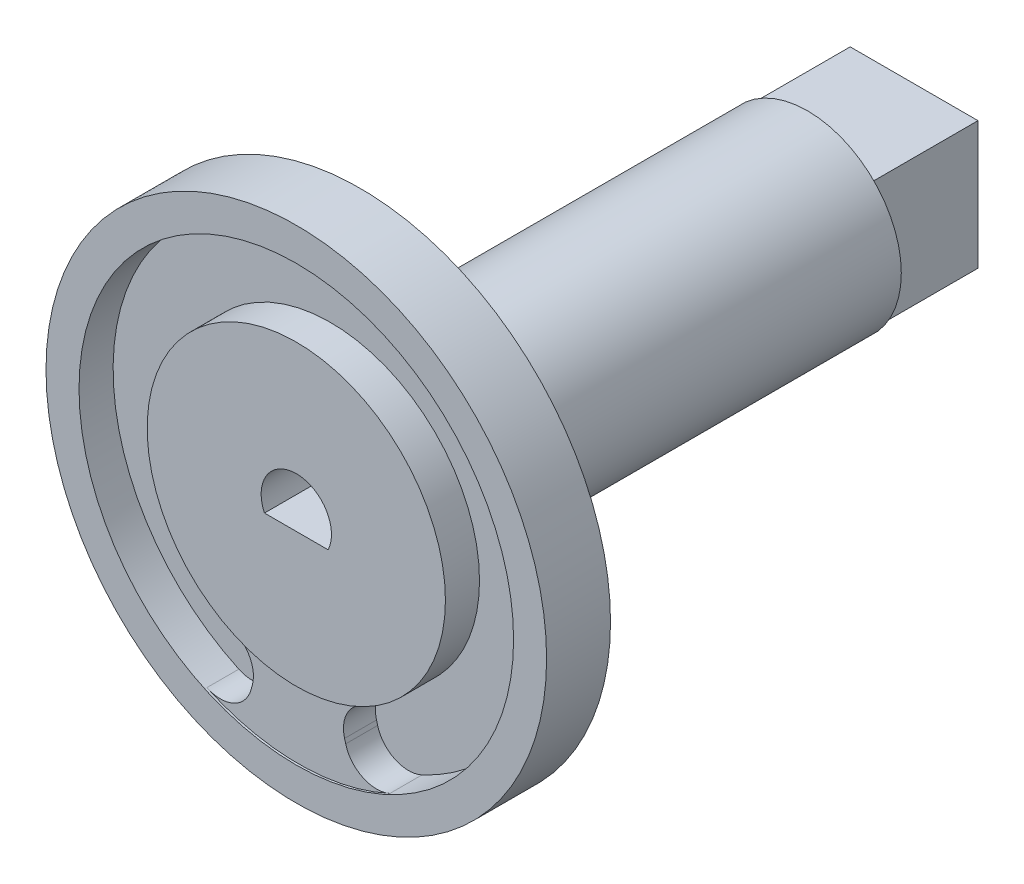
from build123d import *
from build123d.topology import SkipClean

# Parameters (mm, degrees)
SKETCH_1_R          = 11.75
EXTRUDE_1_DEPTH     = 3
CUT_EXTRUDE_1_DEPTH = 13
SKETCH_3_R          = 10.2
SKETCH_3_R_2        = 7
CUT_EXTRUDE_2_DEPTH = 1.6
EXTRUDE_START       = 1.5
EXTRUDE_2_DEPTH     = 1.5
FILLET_1_R          = 1.5
EXTRUDE_START_2     = 2
SKETCH_7_R          = 4.4
EXTRUDE_4_DEPTH     = 2
EXTRUDE_START_3     = 19
SKETCH_9_R          = 4.4
EXTRUDE_5_DEPTH     = 19
SKETCH_10_W         = 6
SKETCH_10_H         = 6
EXTRUDE_6_DEPTH     = 5
CUT_EXTRUDE_START   = -10
CUT_EXTRUDE_4_DEPTH = 10


with BuildPart() as part:
    # 草图1 → 凸台-拉伸1 (new body)
    with BuildSketch(Plane.XY):
        Circle(SKETCH_1_R)
    extrude(amount=EXTRUDE_1_DEPTH)

    # 草图2 → 切除-拉伸1 (cut)
    with BuildSketch(Plane(origin=(0, 0, 0), x_dir=(-1, 0, 0), z_dir=(0, 0, -1))):
        with BuildLine():
            Line((1.429160593, -0.6), (-1.429160593, -0.6))
            ThreePointArc((-1.429160593, -0.6), (0, 1.55), (1.429160593, -0.6))
        make_face()
    extrude(amount=-CUT_EXTRUDE_1_DEPTH, mode=Mode.SUBTRACT)

    # 草图3 → 切除-拉伸2 (cut)
    with BuildSketch(Plane.XY.offset(3)):
        Circle(SKETCH_3_R)
        Circle(SKETCH_3_R_2, mode=Mode.SUBTRACT)
    extrude(amount=-CUT_EXTRUDE_2_DEPTH, mode=Mode.SUBTRACT)

    # 草图4 → 凸台-拉伸2 (add)
    with BuildSketch(Plane.XY.offset(1.4).offset(EXTRUDE_START)):
        with BuildLine():
            Line((1.811733316, -6.761480784), (2.63995426, -9.852443428))
            ThreePointArc((2.63995426, -9.852443428), (0, -10.2), (-2.63995426, -9.852443428))
            Line((-2.63995426, -9.852443428), (-1.811733316, -6.761480784))
            ThreePointArc((-1.811733316, -6.761480784), (0, -7), (1.811733316, -6.761480784))
        make_face()
    extrude(amount=-EXTRUDE_2_DEPTH)

    # 圆角1
    fillet_1_edges = [part.edges().sort_by_distance(p)[0] for p in [
        (1.811733316, -6.761480784, 2.15),
        (-1.811733316, -6.761480784, 2.15),
        (-2.63995426, -9.852443428, 2.15),
        (2.63995426, -9.852443428, 2.15),
    ]]
    fillet(fillet_1_edges, radius=FILLET_1_R)

    # 草图7 → 凸台-拉伸4 (add)
    with SkipClean():  # the faces are left unmerged after this step: merging them gives an invalid solid
        with BuildSketch(Plane(origin=(0, 0, 0), x_dir=(-1, 0, 0), z_dir=(0, 0, -1)).offset(EXTRUDE_START_2)):
            with Locations(Location((0, 0, 0), (0, 0, 180))):
                Circle(SKETCH_7_R)
            with BuildLine():
                Line((-1.429160593, -0.6), (1.429160593, -0.6))
                ThreePointArc((1.429160593, -0.6), (0, 1.55), (-1.429160593, -0.6))
            make_face(mode=Mode.SUBTRACT)
        extrude(amount=-EXTRUDE_4_DEPTH)

    # 草图9 → 凸台-拉伸5 (add)
    with SkipClean():  # the faces are left unmerged after this step: merging them gives an invalid solid
        with BuildSketch(Plane(origin=(0, 0, -2), x_dir=(-1, 0, 0), z_dir=(0, 0, -1)).offset(EXTRUDE_START_3)):
            with Locations(Location((0, 0, 0), (0, 0, 180))):
                Circle(SKETCH_9_R)
        extrude(amount=-EXTRUDE_5_DEPTH)

    # 草图10 → 凸台-拉伸6 (add)
    with SkipClean():  # the faces are left unmerged after this step: merging them gives an invalid solid
        with BuildSketch(Plane(origin=(0, 0, -21), x_dir=(-1, 0, 0), z_dir=(0, 0, -1))):
            Rectangle(SKETCH_10_W, SKETCH_10_H)
        extrude(amount=EXTRUDE_6_DEPTH)

    # 草图11 → 切除-拉伸4 (cut)
    with BuildSketch(Plane.XY.offset(3).offset(CUT_EXTRUDE_START)):
        with BuildLine():
            Line((1.49415528, -0.7), (-1.49415528, -0.7))
            ThreePointArc((-1.49415528, -0.7), (0, 1.65), (1.49415528, -0.7))
        make_face()
        with BuildLine():
            Line((1.429160593, -0.6), (-1.429160593, -0.6))
            ThreePointArc((-1.429160593, -0.6), (0, 1.55), (1.429160593, -0.6))
        make_face(mode=Mode.SUBTRACT)
    extrude(amount=CUT_EXTRUDE_4_DEPTH, mode=Mode.SUBTRACT)


solid = part.part
